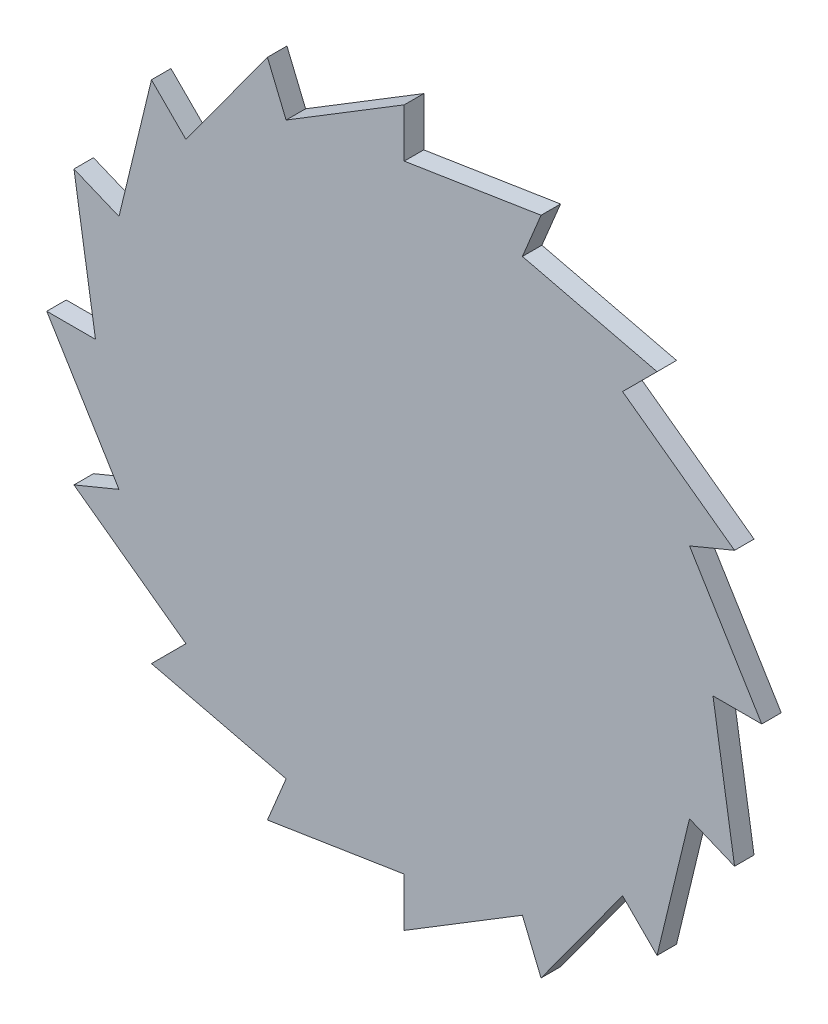
from build123d import *

# Parameters (mm, degrees)
SKETCH1_R           = 55
BOSS_EXTRUDE1_DEPTH = 3
CUT_EXTRUDE1_DEPTH  = 3
SKETCH3_R           = 2.5
CUT_EXTRUDE2_DEPTH  = 2


with BuildPart() as part:
    # Sketch1 → Boss-Extrude1 (new body)
    with BuildSketch(Plane.XY):
        Circle(SKETCH1_R)
    extrude(amount=BOSS_EXTRUDE1_DEPTH)

    # Sketch2 → Cut-Extrude1 (cut)
    with BuildSketch(Plane(origin=(0, 0, 0), x_dir=(-1, 0, 0), z_dir=(0, 0, -1))):
        with BuildLine():
            Line((43.884277794, 18.177463037), (50.813374288, 21.04758878))
            ThreePointArc((50.813374288, 21.04758878), (45.730828677, 30.556362816), (38.890872965, 38.890872965))
            Line((38.890872965, 38.890872965), (43.884277794, 18.177463037))
        make_face()
        with BuildLine():
            Line((33.587572106, 33.587572106), (38.890872965, 38.890872965))
            ThreePointArc((38.890872965, 38.890872965), (30.556362816, 45.730828677), (21.04758878, 50.813374288))
            Line((21.04758878, 50.813374288), (33.587572106, 33.587572106))
        make_face()
        with BuildLine():
            Line((18.177463037, 43.884277794), (21.04758878, 50.813374288))
            ThreePointArc((21.04758878, 50.813374288), (10.729967711, 53.943190422), (0, 55))
            Line((0, 55), (18.177463037, 43.884277794))
        make_face()
        with BuildLine():
            Line((0, 47.5), (0, 55))
            ThreePointArc((0, 55), (-10.729967711, 53.943190422), (-21.04758878, 50.813374288))
            Line((-21.04758878, 50.813374288), (0, 47.5))
        make_face()
        with BuildLine():
            Line((-18.177463037, 43.884277794), (-21.04758878, 50.813374288))
            ThreePointArc((-21.04758878, 50.813374288), (-30.556362816, 45.730828677), (-38.890872965, 38.890872965))
            Line((-38.890872965, 38.890872965), (-18.177463037, 43.884277794))
        make_face()
        with BuildLine():
            Line((-33.587572106, 33.587572106), (-38.890872965, 38.890872965))
            ThreePointArc((-38.890872965, 38.890872965), (-45.730828677, 30.556362816), (-50.813374288, 21.04758878))
            Line((-50.813374288, 21.04758878), (-33.587572106, 33.587572106))
        make_face()
        with BuildLine():
            Line((-43.884277794, 18.177463037), (-50.813374288, 21.04758878))
            ThreePointArc((-50.813374288, 21.04758878), (-53.943190422, 10.729967711), (-55, 0))
            Line((-55, 0), (-43.884277794, 18.177463037))
        make_face()
        with BuildLine():
            ThreePointArc((-55, 0), (-53.943190422, -10.729967711), (-50.813374288, -21.04758878))
            Line((-50.813374288, -21.04758878), (-47.5, 0))
            Line((-47.5, 0), (-55, 0))
        make_face()
        with BuildLine():
            ThreePointArc((-50.813374288, -21.04758878), (-45.730828677, -30.556362816), (-38.890872965, -38.890872965))
            Line((-38.890872965, -38.890872965), (-43.884277794, -18.177463037))
            Line((-43.884277794, -18.177463037), (-50.813374288, -21.04758878))
        make_face()
        with BuildLine():
            ThreePointArc((-38.890872965, -38.890872965), (-30.556362816, -45.730828677), (-21.04758878, -50.813374288))
            Line((-21.04758878, -50.813374288), (-33.587572106, -33.587572106))
            Line((-33.587572106, -33.587572106), (-38.890872965, -38.890872965))
        make_face()
        with BuildLine():
            ThreePointArc((-21.04758878, -50.813374288), (-10.729967711, -53.943190422), (0, -55))
            Line((0, -55), (-18.177463037, -43.884277794))
            Line((-18.177463037, -43.884277794), (-21.04758878, -50.813374288))
        make_face()
        with BuildLine():
            ThreePointArc((0, -55), (10.729967711, -53.943190422), (21.04758878, -50.813374288))
            Line((21.04758878, -50.813374288), (0, -47.5))
            Line((0, -47.5), (0, -55))
        make_face()
        with BuildLine():
            ThreePointArc((21.04758878, -50.813374288), (30.556362816, -45.730828677), (38.890872965, -38.890872965))
            Line((38.890872965, -38.890872965), (18.177463037, -43.884277794))
            Line((18.177463037, -43.884277794), (21.04758878, -50.813374288))
        make_face()
        with BuildLine():
            ThreePointArc((38.890872965, -38.890872965), (45.730828677, -30.556362816), (50.813374288, -21.04758878))
            Line((50.813374288, -21.04758878), (33.587572106, -33.587572106))
            Line((33.587572106, -33.587572106), (38.890872965, -38.890872965))
        make_face()
        with BuildLine():
            ThreePointArc((50.813374288, -21.04758878), (53.943190422, -10.729967711), (55, 0))
            Line((55, 0), (43.884277794, -18.177463037))
            Line((43.884277794, -18.177463037), (50.813374288, -21.04758878))
        make_face()
        with BuildLine():
            Line((50.813374288, 21.04758878), (47.5, 0))
            Line((47.5, 0), (55, 0))
            ThreePointArc((55, 0), (53.943190422, 10.729967711), (50.813374288, 21.04758878))
        make_face()
    extrude(amount=-CUT_EXTRUDE1_DEPTH, mode=Mode.SUBTRACT)

    # Sketch3 → Cut-Extrude2 (cut)
    with BuildSketch(Plane(origin=(0, 0, 0), x_dir=(-1, 0, 0), z_dir=(0, 0, -1))):
        Circle(SKETCH3_R)
    extrude(amount=-CUT_EXTRUDE2_DEPTH, mode=Mode.SUBTRACT)


solid = part.part
